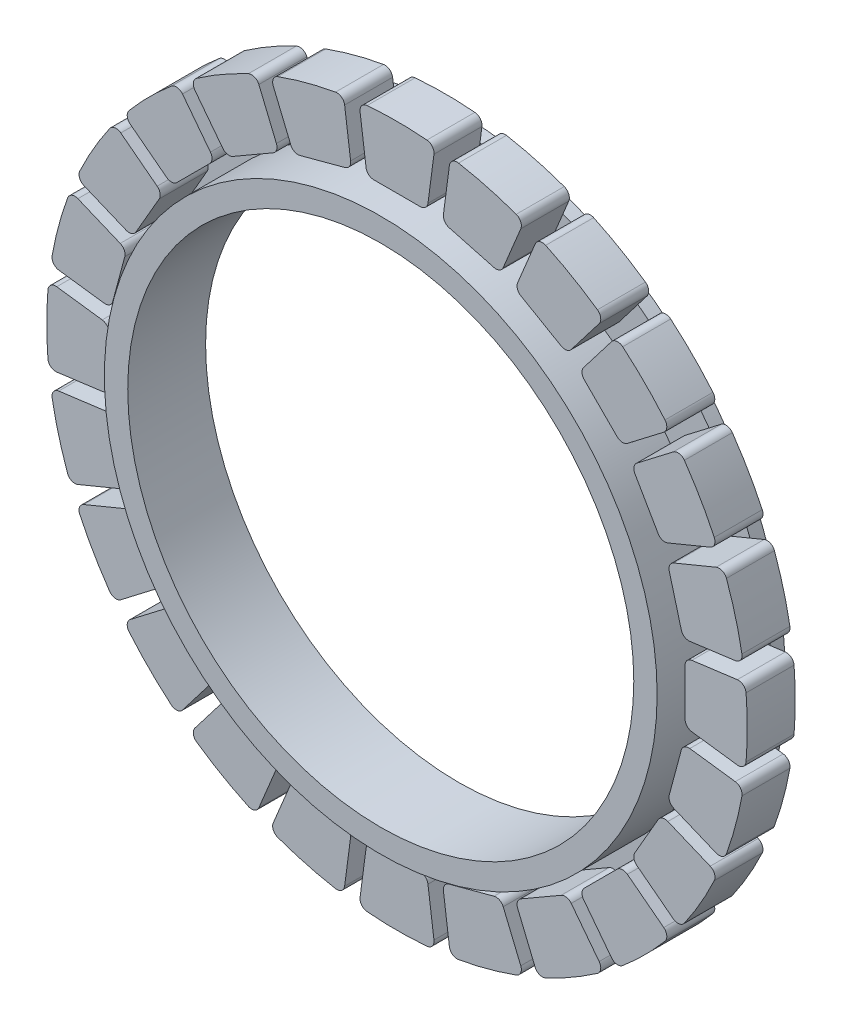
from build123d import *

# Parameters (mm, degrees)
BOSS_EXTRUDE1_DEPTH = 20
CUT_EXTRUDE1_START  = -3.5
CUT_EXTRUDE1_DEPTH  = 3.5
CUT_EXTRUDE2_START  = -16.5
CUT_EXTRUDE2_DEPTH  = 16.5
CUT_EXTRUDE3_START  = -4.175
CUT_EXTRUDE3_DEPTH  = 4.175
BOSS_EXTRUDE2_START = -3.5
BOSS_EXTRUDE2_DEPTH = 3.5
FILLET1_R           = 2
CIRPATTERN1_COUNT   = 24


with BuildPart() as part:
    # Sketch1 → Boss-Extrude1 (new body)
    with BuildSketch(Plane.XY):
        with BuildLine():
            Line((-8.978202217, 83.518811563), (-7.7250269, 74))
            ThreePointArc((-7.7250269, 74), (-8.71901412, 73.889477149), (-9.711425926, 73.765603414))
            Line((-9.711425926, 73.765603414), (-8.484202494, 64.443915989))
            ThreePointArc((-8.484202494, 64.443915989), (0, 65), (8.484202494, 64.443915989))
            Line((8.484202494, 64.443915989), (9.711425926, 73.765603414))
            ThreePointArc((9.711425926, 73.765603414), (8.71901412, 73.889477149), (7.7250269, 74))
            Line((7.7250269, 74), (8.978202217, 83.518811563))
            Line((8.978202217, 83.518811563), (9.761566637, 89.469055079))
            ThreePointArc((9.761566637, 89.469055079), (0, 90), (-9.761566637, 89.469055079))
            Line((-9.761566637, 89.469055079), (-8.978202217, 83.518811563))
        make_face()
    extrude(amount=BOSS_EXTRUDE1_DEPTH)

    # Sketch2 → Cut-Extrude1 (cut)
    with BuildSketch(Plane(origin=(0, 0, 0), x_dir=(-1, 0, 0), z_dir=(0, 0, -1)).offset(CUT_EXTRUDE1_START)):
        with BuildLine():
            Line((-9.761566637, 89.469055079), (-8.978202217, 83.518811563))
            ThreePointArc((-8.978202217, 83.518811563), (0, 84), (8.978202217, 83.518811563))
            Line((8.978202217, 83.518811563), (9.761566637, 89.469055079))
            ThreePointArc((9.761566637, 89.469055079), (0, 90), (-9.761566637, 89.469055079))
        make_face()
    extrude(amount=CUT_EXTRUDE1_DEPTH, mode=Mode.SUBTRACT)

    # Sketch3 → Cut-Extrude2 (cut)
    with BuildSketch(Plane.XY.offset(20).offset(CUT_EXTRUDE2_START)):
        with BuildLine():
            Line((7.7250269, 74), (-7.7250269, 74))
            ThreePointArc((-7.7250269, 74), (-8.71901412, 73.889477149), (-9.711425926, 73.765603414))
            Line((-9.711425926, 73.765603414), (-9.267359648, 70.392585158))
            ThreePointArc((-9.267359648, 70.392585158), (0, 71), (9.267359648, 70.392585158))
            Line((9.267359648, 70.392585158), (9.711425926, 73.765603414))
            ThreePointArc((9.711425926, 73.765603414), (8.71901412, 73.889477149), (7.7250269, 74))
        make_face()
    extrude(amount=CUT_EXTRUDE2_DEPTH, mode=Mode.SUBTRACT)

    # Sketch4 → Cut-Extrude3 (cut)
    with BuildSketch(Plane.XY.offset(20).offset(CUT_EXTRUDE3_START)):
        with BuildLine():
            Line((-7.7250269, 74), (7.7250269, 74))
            Line((7.7250269, 74), (9.761566637, 89.469055079))
            ThreePointArc((9.761566637, 89.469055079), (0, 90), (-9.761566637, 89.469055079))
            Line((-9.761566637, 89.469055079), (-7.7250269, 74))
        make_face()
    extrude(amount=CUT_EXTRUDE3_DEPTH, mode=Mode.SUBTRACT)

    # Sketch5 → Boss-Extrude2 (add)
    with BuildSketch(Plane.XY.offset(3.5).offset(BOSS_EXTRUDE2_START)):
        with BuildLine():
            Line((9.711425926, 73.765603414), (10.964200146, 83.281368355))
            ThreePointArc((10.964200146, 83.281368355), (9.971907933, 83.406001296), (8.978202217, 83.518811563))
            Line((8.978202217, 83.518811563), (7.7250269, 74))
            ThreePointArc((7.7250269, 74), (8.71901412, 73.889477149), (9.711425926, 73.765603414))
        make_face()
        with BuildLine():
            Line((-9.711425926, 73.765603414), (-10.964200146, 83.281368355))
            ThreePointArc((-10.964200146, 83.281368355), (-9.971907933, 83.406001296), (-8.978202217, 83.518811563))
            Line((-8.978202217, 83.518811563), (-7.7250269, 74))
            ThreePointArc((-7.7250269, 74), (-8.71901412, 73.889477149), (-9.711425926, 73.765603414))
        make_face()
    extrude(amount=BOSS_EXTRUDE2_DEPTH)

    # Fillet1
    fillet1_edges = [part.edges().sort_by_distance(p)[0] for p in [
        (7.7250269, 74, 9.6625),
        (-7.7250269, 74, 9.6625),
        (9.761566637, 89.469055079, 9.6625),
        (-9.761566637, 89.469055079, 9.6625),
    ]]
    fillet(fillet1_edges, radius=FILLET1_R)

    # CirPattern1: part ×24 about axis
    cirpattern1_axis = Axis((0, 0, 0), (0, 0, 1))


with BuildPart() as part_1:
    add(part.part)
    for i in range(1, CIRPATTERN1_COUNT):
        add(part.part.rotate(cirpattern1_axis, i * 360 / CIRPATTERN1_COUNT))


solid = part_1.part
